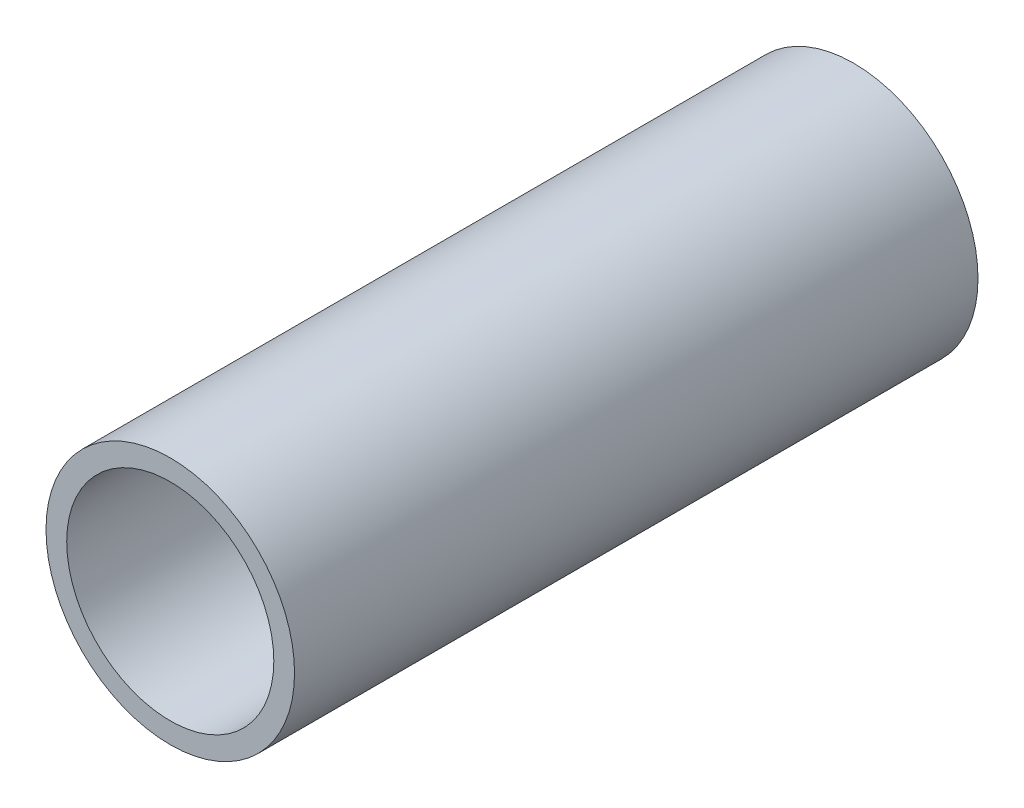
from build123d import *

# Parameters (mm, degrees)
ESQUISSE1_R        = 6
ESQUISSE1_R_2      = 5
BOSS_EXTRU_1_DEPTH = 33


with BuildPart() as part:
    # Esquisse1 → Boss.-Extru.1 (new body)
    with BuildSketch(Plane.XY):
        Circle(ESQUISSE1_R)
        Circle(ESQUISSE1_R_2, mode=Mode.SUBTRACT)
    extrude(amount=BOSS_EXTRU_1_DEPTH)


solid = part.part
